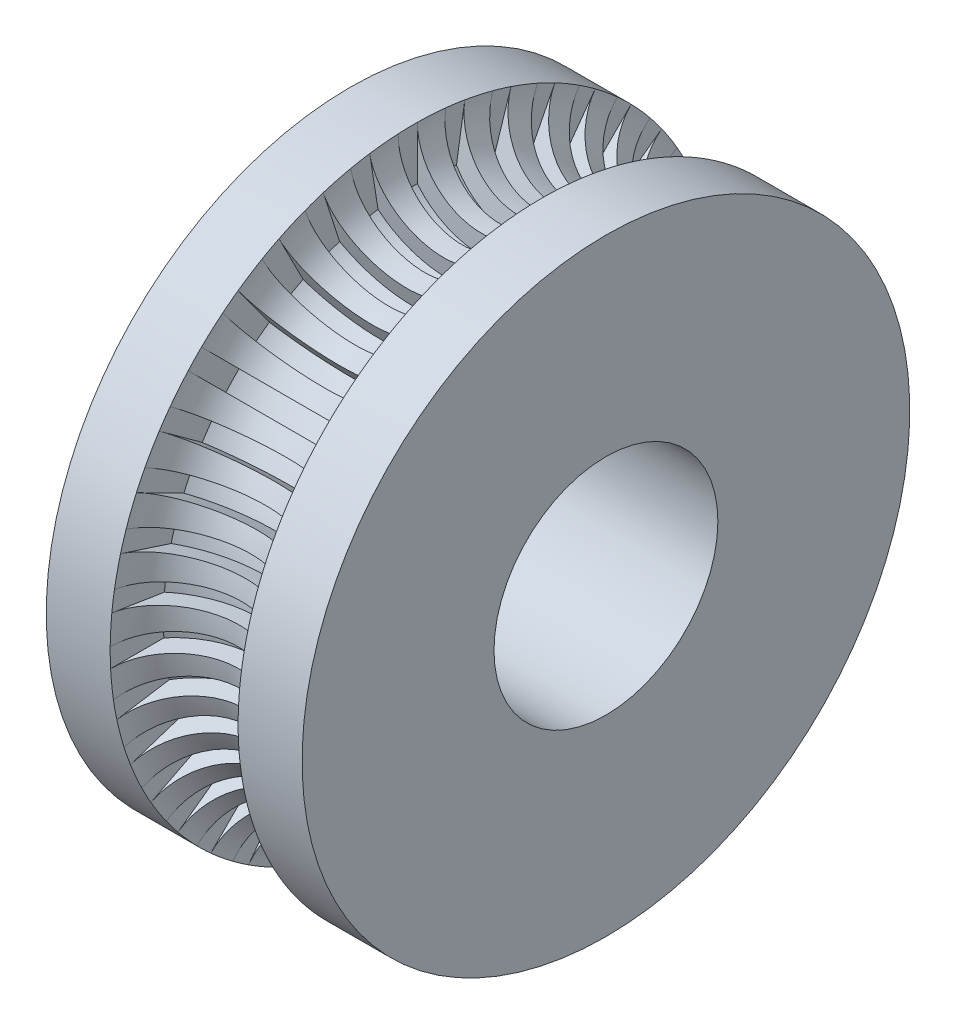
from build123d import *

# Parameters (mm, degrees)
SKETCH3_R                     = 1.75
CUT_EXTRUDE1_DEPTH            = 4
CUT_EXTRUDE2_REACH            = 13.35
CUT_EXTRUDE2_END_MAJOR_RADIUS = 4.75
CUT_EXTRUDE2_END_MINOR_RADIUS = 1.3
SKETCH5_W                     = 2
SKETCH5_H                     = 0.3
CIRPATTERN1_COUNT             = 40


with BuildPart() as part:
    # Sketch1 → Revolve1 (revolve)
    with BuildSketch(Plane.XY):
        with BuildLine():
            Line((0, 0), (0, 4.75))
            Line((0, 4.75), (1, 4.75))
            ThreePointArc((1, 4.75), (2, 3.75), (3, 4.75))
            Line((3, 4.75), (4, 4.75))
            Line((4, 4.75), (4, 0))
            Line((4, 0), (0, 0))
        make_face()
    revolve(axis=Axis((4, 0, 0), (-1, 0, 0)))

    # Sketch3 → Cut-Extrude1 (cut)
    with BuildSketch(Plane.ZY):
        with Locations(Location((0, 0, 0), (0, 0, 270))):
            Circle(SKETCH3_R)
    extrude(amount=-CUT_EXTRUDE1_DEPTH, mode=Mode.SUBTRACT)

    # Cut-Extrude2: up to this torus (the profile starts inside it)
    cut_extrude2_end = Plane(origin=(2, 0, 0), z_dir=(1, 0, 0)) * Torus(CUT_EXTRUDE2_END_MAJOR_RADIUS, CUT_EXTRUDE2_END_MINOR_RADIUS, mode=Mode.PRIVATE)
    # Sketch5 → Cut-Extrude2 (cut, up to the surface)
    with BuildSketch(Plane.XY.offset(4.75), mode=Mode.PRIVATE) as cut_extrude2_sk1:
        with Locations((2, -0.099168606)):
            Rectangle(SKETCH5_W, SKETCH5_H)
    cut_extrude2_tool1 = extrude(cut_extrude2_sk1.sketch, amount=-CUT_EXTRUDE2_REACH, mode=Mode.PRIVATE) & cut_extrude2_end
    cut_extrude2 = cut_extrude2_tool1.solids().sort_by_distance((2, -0.099169, 4.75))[0]
    add(cut_extrude2, mode=Mode.SUBTRACT)

    # CirPattern1: Cut-Extrude2 ×40 about axis
    cirpattern1_axis = Axis((0, 0, 0), (1, 0, 0))
    for i in range(1, CIRPATTERN1_COUNT):
        add(cut_extrude2.rotate(cirpattern1_axis, i * 360 / CIRPATTERN1_COUNT), mode=Mode.SUBTRACT)


solid = part.part
